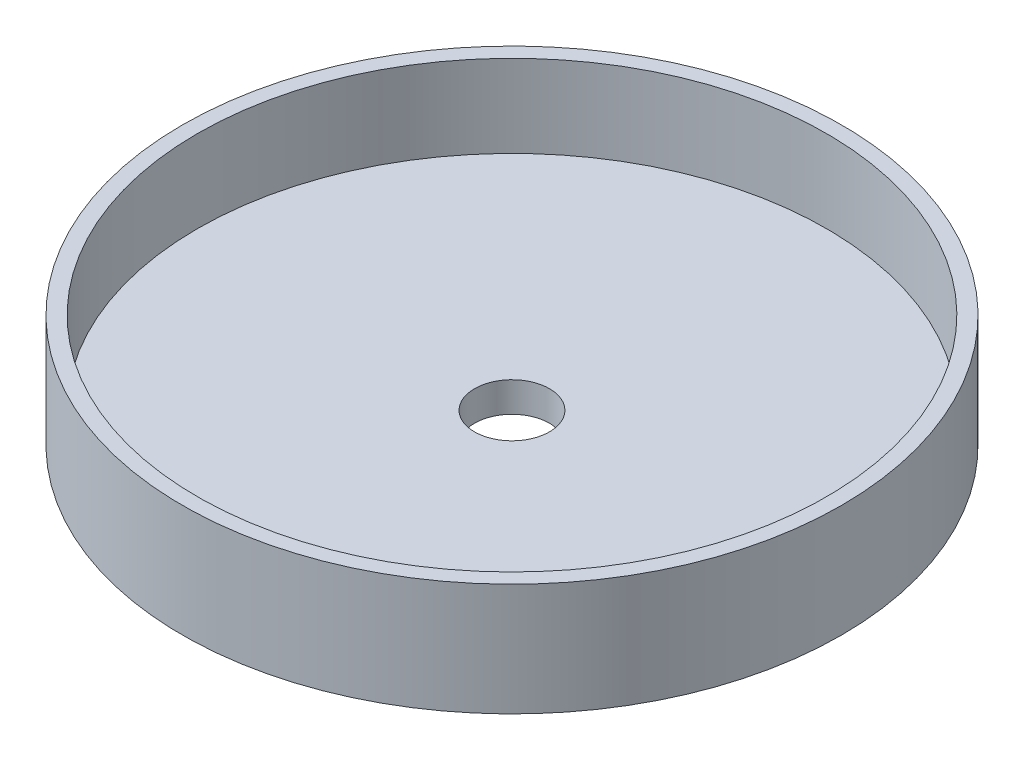
from build123d import *


with BuildPart() as part:
    # Sketch1 → Revolve1 (revolve)
    with BuildSketch(Plane.XY, mode=Mode.PRIVATE) as revolve1_sk:
        Polygon((5, 4), (5, 0), (44, 0), (44, 15), (42, 15), (42, 4), align=None)
    revolve(revolve1_sk.sketch.rotate(Axis((0, 4, 0), (0, -1, 0)), 180), axis=Axis((0, 4, 0), (0, -1, 0)))


solid = part.part
